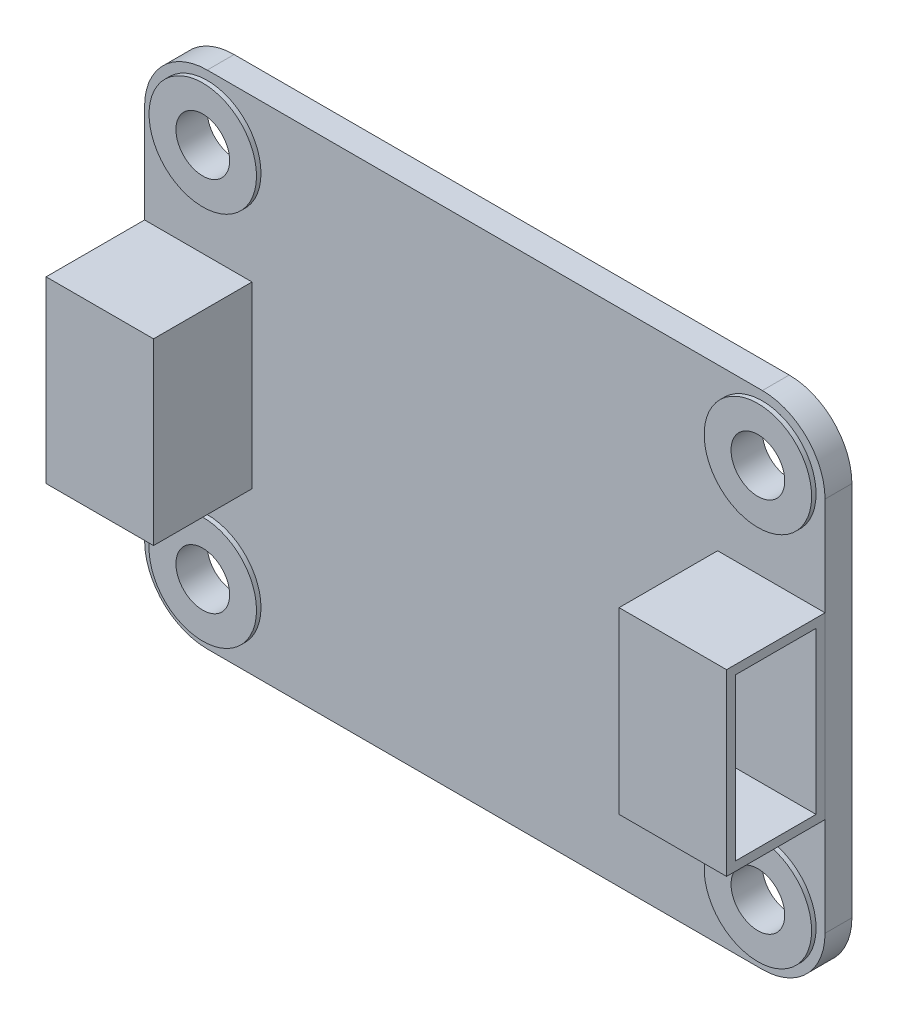
from build123d import *

# Parameters (mm, degrees)
ESQUISSE1_R        = 1.5
BOSS_EXTRU_1_DEPTH = 1.5
ESQUISSE2_R        = 3
ESQUISSE2_R_2      = 1.5
BOSS_EXTRU_2_DEPTH = 0.25
ESQUISSE11_W       = 6
ESQUISSE11_H       = 10
BOSS_EXTRU_9_DEPTH = 5.5
COQUE1_T           = -0.5


with BuildPart() as part:
    # Esquisse1 → Boss.-Extru.1 (new body)
    with BuildSketch(Plane.XY):
        with BuildLine():
            ThreePointArc((-19, 10.5), (-17.974873734, 12.974873734), (-15.5, 14))
            Line((-15.5, 14), (15.5, 14))
            ThreePointArc((15.5, 14), (17.974873734, 12.974873734), (19, 10.5))
            Line((19, 10.5), (19, -10.5))
            ThreePointArc((19, -10.5), (17.974873734, -12.974873734), (15.5, -14))
            Line((15.5, -14), (-15.5, -14))
            ThreePointArc((-15.5, -14), (-17.974873734, -12.974873734), (-19, -10.5))
            Line((-19, -10.5), (-19, 10.5))
        make_face()
        with Locations((15.5, -10.5)):
            Circle(ESQUISSE1_R, mode=Mode.SUBTRACT)
        with Locations((15.5, 10.5)):
            Circle(ESQUISSE1_R, mode=Mode.SUBTRACT)
        with Locations((-15.5, -10.5)):
            Circle(ESQUISSE1_R, mode=Mode.SUBTRACT)
        with Locations((-15.5, 10.5)):
            Circle(ESQUISSE1_R, mode=Mode.SUBTRACT)
    extrude(amount=BOSS_EXTRU_1_DEPTH)

    # Esquisse2 → Boss.-Extru.2 (add)
    # profile 1 of 4: a face of its own
    with BuildSketch(Plane.XY.offset(1.5)):
        with Locations((15.5, 10.5)):
            Circle(ESQUISSE2_R)
        with Locations((15.5, 10.5)):
            Circle(ESQUISSE2_R_2, mode=Mode.SUBTRACT)
    # profile 2 of 4: a face of its own
    with BuildSketch(Plane.XY.offset(1.5)):
        with Locations((-15.5, 10.5)):
            Circle(ESQUISSE2_R)
        with Locations((-15.5, 10.5)):
            Circle(ESQUISSE2_R_2, mode=Mode.SUBTRACT)
    # profile 3 of 4: a face of its own
    with BuildSketch(Plane.XY.offset(1.5)):
        with Locations((-15.5, -10.5)):
            Circle(ESQUISSE2_R)
        with Locations((-15.5, -10.5)):
            Circle(ESQUISSE2_R_2, mode=Mode.SUBTRACT)
    # profile 4 of 4: a face of its own
    with BuildSketch(Plane.XY.offset(1.5)):
        with Locations((15.5, -10.5)):
            Circle(ESQUISSE2_R)
        with Locations((15.5, -10.5)):
            Circle(ESQUISSE2_R_2, mode=Mode.SUBTRACT)
    extrude(amount=BOSS_EXTRU_2_DEPTH)


with BuildPart() as body_2:
    # Esquisse11 → Boss.-Extru.9 (new body)
    with BuildSketch(Plane.XY.offset(1.5)):
        with Locations((16, 0)):
            Rectangle(ESQUISSE11_W, ESQUISSE11_H)
    extrude(amount=BOSS_EXTRU_9_DEPTH)

    # Coque1
    coque1_openings = [body_2.faces().sort_by_distance(p)[0] for p in [
        (19, 0, 4.25),
    ]]
    offset(amount=COQUE1_T, openings=coque1_openings, kind=Kind.INTERSECTION)


with BuildPart() as body_3:
    # Symétrie1: mirrored copy
    add(body_2.part.mirror(Plane(origin=(0, 0, 0), x_dir=(0, 0, 1), z_dir=(1, 0, 0))))


solid = Compound([part.part, body_2.part, body_3.part])
